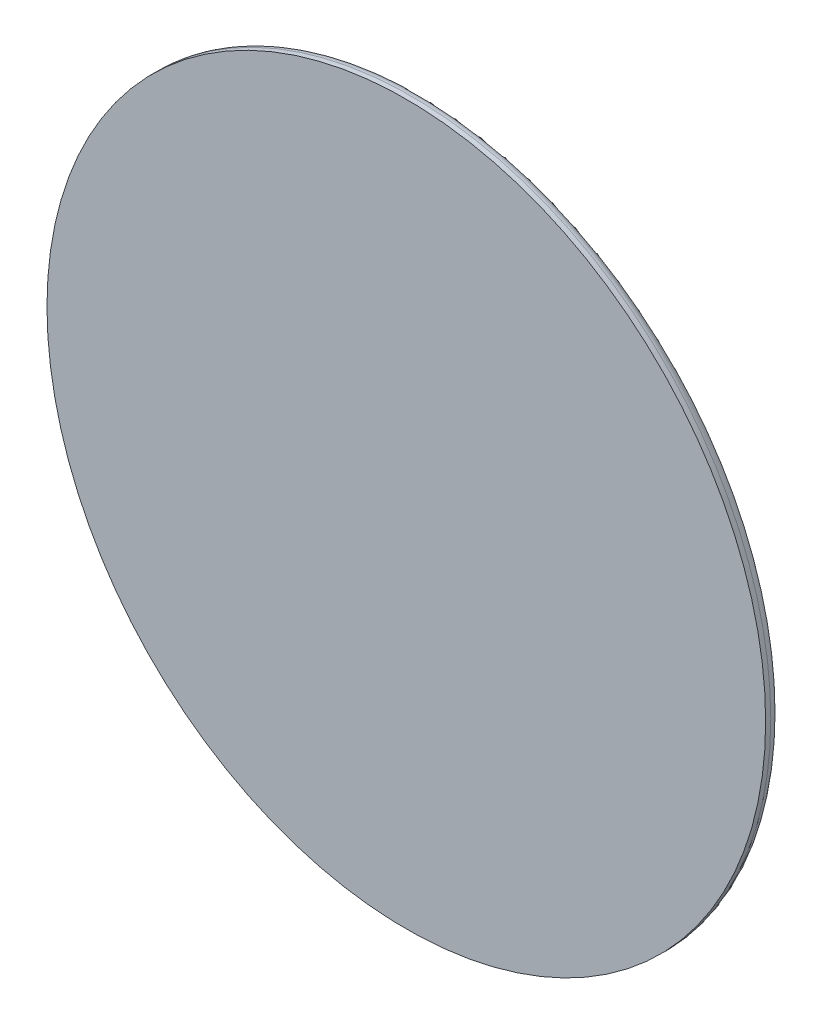
from build123d import *

# Parameters (mm, degrees)
BOSS_EXTRUDE1_DEPTH = 15
FILLET1_R           = 10
BOSS_EXTRUDE2_START = -0.9999999999999974
SKETCH4_R           = 8.890000000000002
SKETCH4_R_2         = 8.890000000000008
SKETCH4_R_3         = 8.890000000000004
BOSS_EXTRUDE2_DEPTH = 0.9999999999999974


with BuildPart() as part:
    # Sketch2 → Boss-Extrude1 (new body)
    with BuildSketch(Plane.XY):
        with BuildLine():
            Line((0, 0), (-291.11000000000007, 0))
            ThreePointArc((-291.11000000000007, -2.18e-15), (-293.667421840922, -6.23943537983746), (-299.86827983333353, -8.889024119536039))
            ThreePointArc((-299.8682798333336, -8.88902411952966), (-5.91709e-12, -300.00000000000006), (299.86827983333325, -8.889024119541757))
            ThreePointArc((299.86827983333325, -8.889024119536035), (293.66742184092186, -6.23943537983736), (291.11000000000007, 1.09e-15))
            Line((291.1100000000001, 0), (0, 0))
        make_face()
        with BuildLine():
            ThreePointArc((-299.86827983333353, 8.889024119536039), (-293.667421840922, 6.23943537983746), (-291.11000000000007, 0))
            Line((-291.11000000000007, 0), (0, 0))
            Line((0, 0), (0, 291.11000000000007))
            ThreePointArc((1.0101e-13, 291.11000000000007), (-6.239435379837412, 293.6674218409219), (-8.889024119536034, 299.86827983333353))
            ThreePointArc((-8.889024119531676, 299.86827983333353), (-212.13203435596503, 212.13203435596358), (-299.8682798333336, 8.8890241195296))
        make_face()
        with BuildLine():
            Line((0, 291.11000000000007), (0, 0))
            Line((0, 0), (291.1100000000001, 0))
            ThreePointArc((291.11000000000007, 1.09e-15), (293.66742184092186, 6.239435379837364), (299.86827983333325, 8.889024119536035))
            ThreePointArc((299.86827983333325, 8.889024119541785), (212.1320343559607, 212.13203435596787), (8.889024119531646, 299.86827983333353))
            ThreePointArc((8.889024119536034, 299.86827983333353), (6.239435379837482, 293.66742184092203), (1.0101e-13, 291.11000000000007))
        make_face()
        with BuildLine():
            ThreePointArc((299.86827983333325, -8.889024119541757), (-5.91709e-12, -300.00000000000006), (-299.8682798333336, -8.88902411952966))
            ThreePointArc((-299.86827983333353, -8.889024119536039), (-306.2394353798375, -6.332578159078076), (-308.89000000000004, 1.09e-15))
            Line((-308.89000000000004, 0), (-350, 0))
            ThreePointArc((-350, 4.286e-14), (-6.429e-14, -350), (350, -8.573e-14))
            Line((350, 0), (308.8900000000001, 0))
            ThreePointArc((308.89000000000004, -2.18e-15), (306.2394353798374, -6.332578159078179), (299.86827983333325, -8.889024119536035))
        make_face()
        with BuildLine():
            ThreePointArc((8.889024119531646, 299.86827983333353), (212.1320343559607, 212.13203435596787), (299.86827983333325, 8.889024119541785))
            ThreePointArc((299.86827983333325, 8.889024119536035), (306.2394353798374, 6.332578159078173), (308.89000000000004, 0))
            Line((308.8900000000001, 0), (350, 0))
            ThreePointArc((350, 0), (247.48737341529164, 247.48737341529161), (9.915e-14, 350))
            Line((0, 350), (0, 308.89000000000004))
            ThreePointArc((9.924e-14, 308.89000000000004), (6.286179284748443, 306.2861792847484), (8.89, 300.00000000000006))
            ThreePointArc((8.89, 300.00000000000006), (8.889756026536256, 299.9341381091804), (8.889024119536034, 299.86827983333353))
        make_face()
        with BuildLine():
            ThreePointArc((-308.89000000000004, 1.09e-15), (-306.2394353798375, 6.332578159078078), (-299.86827983333353, 8.889024119536039))
            ThreePointArc((-299.8682798333336, 8.8890241195296), (-212.13203435596503, 212.13203435596358), (-8.889024119531676, 299.86827983333353))
            ThreePointArc((-8.889024119536034, 299.86827983333353), (-6.332578159078046, 306.2394353798375), (9.924e-14, 308.89000000000004))
            Line((0, 308.89000000000004), (0, 350))
            ThreePointArc((2.143e-14, 350), (-247.48737341529161, 247.48737341529164), (-350, 4.286e-14))
            Line((-350, 0), (-308.89000000000004, 0))
        make_face()
    extrude(amount=BOSS_EXTRUDE1_DEPTH)

    # Fillet1
    fillet1_edges = [part.edges().sort_by_distance(p)[0] for p in [
        (291.11000000000007, -3.375e-14, 0),
        (8.889024119535959, 300.13172016666664, 0),
        (-300.1317201666668, -8.889024119535831, 0),
        (-350, -1.4099e-13, 0),
    ]]
    fillet(fillet1_edges, radius=FILLET1_R)

    # Sketch4 → Boss-Extrude2 (add)
    with BuildSketch(Plane.XY.offset(15).offset(BOSS_EXTRUDE2_START)):
        with Locations((0, 300.00000000000006)):
            Circle(SKETCH4_R)
        with Locations((300.00000000000006, 0)):
            Circle(SKETCH4_R_2)
        with Locations((-300.00000000000006, 0)):
            Circle(SKETCH4_R_3)
    extrude(amount=BOSS_EXTRUDE2_DEPTH)


solid = part.part
